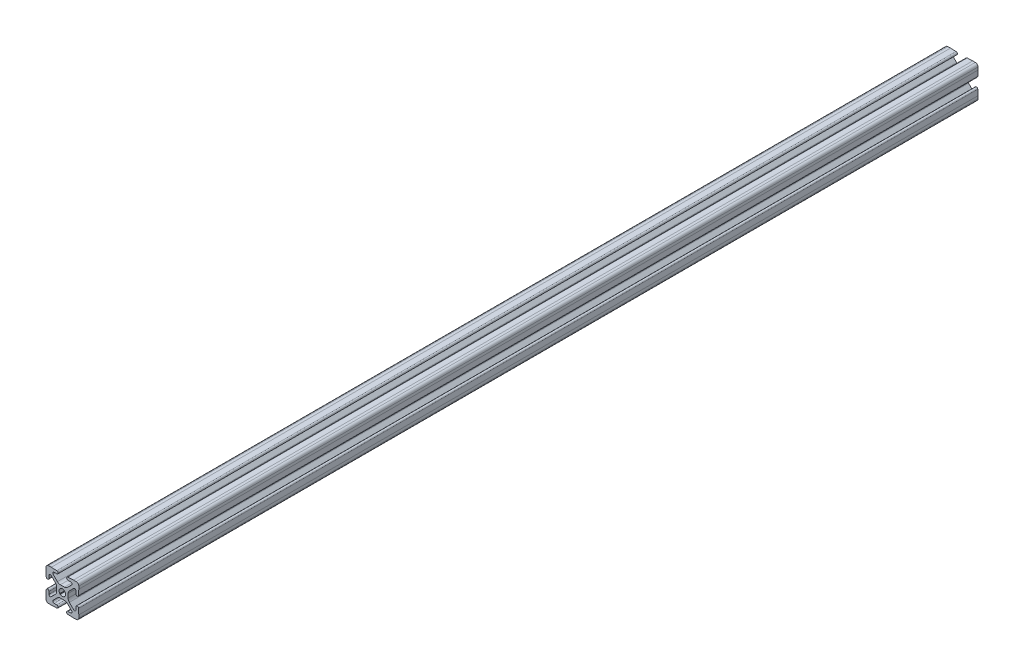
from build123d import *

# Parameters (mm, degrees)
BOSS_EXTRUDE1_DEPTH = 685.8


with BuildPart() as part:
    # Model → Boss-Extrude1 (new body)
    with BuildSketch(Plane.XY):
        with BuildLine():
            Line((50.659960212, 72.999871414), (53.774553856, 72.999871414))
            ThreePointArc((53.774553856, 72.999871414), (54.989573754, 72.758188929), (56.019617887, 72.069935444))
            Line((56.019617887, 72.069935444), (59.264200891, 68.825352439))
            ThreePointArc((59.264200891, 68.825352439), (59.477513437, 67.701802895), (58.510322513, 67.091550869))
            Line((58.510322513, 67.091550869), (56.572487817, 67.159221548))
            ThreePointArc((56.572487817, 67.159221548), (55.4691069, 66.130302197), (56.498026251, 65.026921279))
            Line((56.498026251, 65.026921279), (60.677257034, 64.880979325))
            Line((60.677257034, 64.880979325), (62.710657034, 64.880979325))
            ThreePointArc((62.710657034, 64.880979325), (64.129537501, 65.468698857), (64.717257034, 66.887579325))
            Line((64.717257034, 66.887579325), (64.717257034, 68.920979325))
            Line((64.717257034, 68.920979325), (64.57131508, 73.100210108))
            ThreePointArc((64.57131508, 73.100210108), (63.467934162, 74.129129459), (62.439014811, 73.025748542))
            Line((62.439014811, 73.025748542), (62.50668549, 71.087913846))
            ThreePointArc((62.50668549, 71.087913846), (61.896433464, 70.120722922), (60.77288392, 70.334035468))
            Line((60.77288392, 70.334035468), (57.528300915, 73.578618472))
            ThreePointArc((57.528300915, 73.578618472), (56.84004743, 74.608662605), (56.598364945, 75.823682503))
            Line((56.598364945, 75.823682503), (56.598364945, 78.938276147))
            ThreePointArc((56.598364945, 78.938276147), (56.84004743, 80.153296044), (57.528300915, 81.183340177))
            Line((57.528300915, 81.183340177), (60.77288392, 84.427923182))
            ThreePointArc((60.77288392, 84.427923182), (61.896433464, 84.641235728), (62.50668549, 83.674044803))
            Line((62.50668549, 83.674044803), (62.439014811, 81.736210108))
            ThreePointArc((62.439014811, 81.736210108), (63.467934162, 80.63282919), (64.57131508, 81.661748542))
            Line((64.57131508, 81.661748542), (64.717257034, 85.840979325))
            Line((64.717257034, 85.840979325), (64.717257034, 87.874379325))
            ThreePointArc((64.717257034, 87.874379325), (64.129537501, 89.293259792), (62.710657034, 89.880979325))
            Line((62.710657034, 89.880979325), (60.677257034, 89.880979325))
            Line((60.677257034, 89.880979325), (56.498026251, 89.73503737))
            ThreePointArc((56.498026251, 89.73503737), (55.4691069, 88.631656452), (56.572487817, 87.602737101))
            Line((56.572487817, 87.602737101), (58.510322513, 87.67040778))
            ThreePointArc((58.510322513, 87.67040778), (59.477513437, 87.060155754), (59.264200891, 85.93660621))
            Line((59.264200891, 85.93660621), (56.019617887, 82.692023205))
            ThreePointArc((56.019617887, 82.692023205), (54.989573754, 82.00376972), (53.774553856, 81.762087236))
            Line((53.774553856, 81.762087236), (50.659960212, 81.762087236))
            ThreePointArc((50.659960212, 81.762087236), (49.444940315, 82.00376972), (48.414896182, 82.692023205))
            Line((48.414896182, 82.692023205), (45.170313177, 85.93660621))
            ThreePointArc((45.170313177, 85.93660621), (44.957000631, 87.060155754), (45.924191556, 87.67040778))
            Line((45.924191556, 87.67040778), (47.862026251, 87.602737101))
            ThreePointArc((47.862026251, 87.602737101), (48.965407169, 88.631656452), (47.936487817, 89.73503737))
            Line((47.936487817, 89.73503737), (43.757257034, 89.880979325))
            Line((43.757257034, 89.880979325), (41.723857034, 89.880979325))
            ThreePointArc((41.723857034, 89.880979325), (40.304976567, 89.293259792), (39.717257034, 87.874379325))
            Line((39.717257034, 87.874379325), (39.717257034, 85.840979325))
            Line((39.717257034, 85.840979325), (39.863198989, 81.661748542))
            ThreePointArc((39.863198989, 81.661748542), (40.966579907, 80.63282919), (41.995499258, 81.736210108))
            Line((41.995499258, 81.736210108), (41.927828579, 83.674044803))
            ThreePointArc((41.927828579, 83.674044803), (42.538080605, 84.641235728), (43.661630149, 84.427923182))
            Line((43.661630149, 84.427923182), (46.906213154, 81.183340177))
            ThreePointArc((46.906213154, 81.183340177), (47.594466639, 80.153296044), (47.836149123, 78.938276147))
            Line((47.836149123, 78.938276147), (47.836149123, 75.823682503))
            ThreePointArc((47.836149123, 75.823682503), (47.594466639, 74.608662605), (46.906213154, 73.578618472))
            Line((46.906213154, 73.578618472), (43.661630149, 70.334035468))
            ThreePointArc((43.661630149, 70.334035468), (42.538080605, 70.120722922), (41.927828579, 71.087913846))
            Line((41.927828579, 71.087913846), (41.995499258, 73.025748542))
            ThreePointArc((41.995499258, 73.025748542), (40.966579907, 74.129129459), (39.863198989, 73.100210108))
            Line((39.863198989, 73.100210108), (39.717257034, 68.920979325))
            Line((39.717257034, 68.920979325), (39.717257034, 66.887579325))
            ThreePointArc((39.717257034, 66.887579325), (40.304976567, 65.468698857), (41.723857034, 64.880979325))
            Line((41.723857034, 64.880979325), (43.757257034, 64.880979325))
            Line((43.757257034, 64.880979325), (47.936487817, 65.026921279))
            ThreePointArc((47.936487817, 65.026921279), (48.965407169, 66.130302197), (47.862026251, 67.159221548))
            Line((47.862026251, 67.159221548), (45.924191556, 67.091550869))
            ThreePointArc((45.924191556, 67.091550869), (44.957000631, 67.701802895), (45.170313177, 68.825352439))
            Line((45.170313177, 68.825352439), (48.414896182, 72.069935444))
            ThreePointArc((48.414896182, 72.069935444), (49.444940315, 72.758188929), (50.659960212, 72.999871414))
        make_face()
        with BuildLine():
            Line((50.64953831, 75.433607249), (50.269884959, 75.433607249))
            Line((50.269884959, 75.433607249), (50.269884959, 75.8132606))
            ThreePointArc((50.269884959, 75.8132606), (53.985023987, 79.148746278), (50.64953831, 75.433607249))
        make_face(mode=Mode.SUBTRACT)
    extrude(amount=BOSS_EXTRUDE1_DEPTH)


solid = part.part
